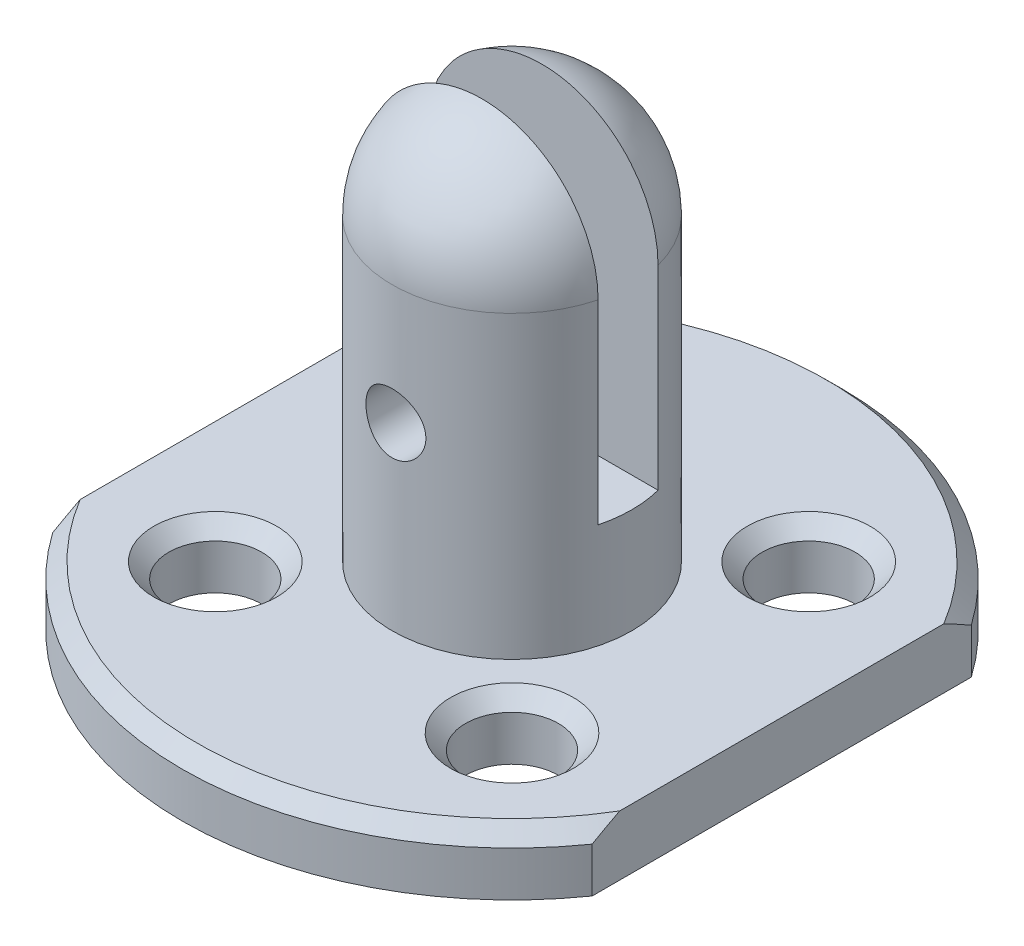
from build123d import *

# Parameters (mm, degrees)
BOSS_EXTRUDE1_DEPTH = 2
SKETCH2_R           = 1.55
CUT_EXTRUDE1_DEPTH  = 15.352700094
CHAMFER1_SIZE       = 0.5
SKETCH4_W           = 2
SKETCH4_H           = 14.133755883
CUT_EXTRUDE2_DEPTH  = 6.5
SKETCH5_R           = 1
CUT_EXTRUDE3_DEPTH  = 6.5
SKETCH6_R           = 3
BOSS_EXTRUDE2_DEPTH = 1


with BuildPart() as part:
    # Sketch1 → Boss-Extrude1 (new body)
    with BuildSketch(Plane(origin=(0, 0, 0), x_dir=(1, 0, 0), z_dir=(0, 1, 0))):
        with BuildLine():
            Line((-9, -6.32455532), (-9, 6.32455532))
            ThreePointArc((-9, 6.32455532), (0, 11), (9, 6.32455532))
            Line((9, 6.32455532), (9, -6.32455532))
            ThreePointArc((9, -6.32455532), (0, -11), (-9, -6.32455532))
        make_face()
    extrude(amount=BOSS_EXTRUDE1_DEPTH)

    # Sketch2 → Cut-Extrude1 (cut, through all)
    with BuildSketch(Plane(origin=(0, 2, 0), x_dir=(1, 0, 0), z_dir=(0, 1, 0))):
        with Locations(Location((4.949747468, 4.949747468, 0), (0, 0, 270))):
            Circle(SKETCH2_R)
        with Locations(Location((4.949747468, -4.949747468, 0), (0, 0, 270))):
            Circle(SKETCH2_R)
        with Locations(Location((-4.949747468, -4.949747468, 0), (0, 0, 270))):
            Circle(SKETCH2_R)
        with Locations(Location((-4.949747468, 4.949747468, 0), (0, 0, 270))):
            Circle(SKETCH2_R)
    extrude(amount=-CUT_EXTRUDE1_DEPTH, mode=Mode.SUBTRACT)

    # Chamfer1
    chamfer1_edges = [part.edges().sort_by_distance(p)[0] for p in [
        (0, 2, -11),
        (-4.949747468, 2, -6.499747468),
        (-4.949747468, 2, 3.399747468),
        (4.949747468, 2, 3.399747468),
        (4.949747468, 2, -6.499747468),
        (0, 2, 11),
    ]]
    chamfer(chamfer1_edges, length=CHAMFER1_SIZE)

    # Sketch3 → Revolve1 (revolve)
    with BuildSketch(Plane.XY):
        with BuildLine():
            Line((0, 2), (4, 2))
            Line((4, 2), (4, 12))
            ThreePointArc((4, 12), (2.828427125, 14.828427125), (0, 16))
            Line((0, 16), (0, 2))
        make_face()
    revolve(axis=Axis((0, 2, 0), (0, 1, 0)))

    # Sketch4 → Cut-Extrude2 (cut, symmetric)
    with BuildSketch(Plane(origin=(0, 0, 0), x_dir=(0, 0, -1), z_dir=(1, 0, 0))):
        with Locations((0, 12.566877942)):
            Rectangle(SKETCH4_W, SKETCH4_H)
    extrude(amount=CUT_EXTRUDE2_DEPTH, both=True, mode=Mode.SUBTRACT)

    # Sketch5 → Cut-Extrude3 (cut, symmetric)
    with BuildSketch(Plane.XY):
        with Locations((0, 8)):
            Circle(SKETCH5_R)
    extrude(amount=CUT_EXTRUDE3_DEPTH, both=True, mode=Mode.SUBTRACT)

    # Sketch6 → Boss-Extrude2 (add)
    with BuildSketch(Plane.XZ):
        with Locations(Location((0, 0, 0), (0, 0, 90))):
            Circle(SKETCH6_R)
    extrude(amount=BOSS_EXTRUDE2_DEPTH)


solid = part.part
